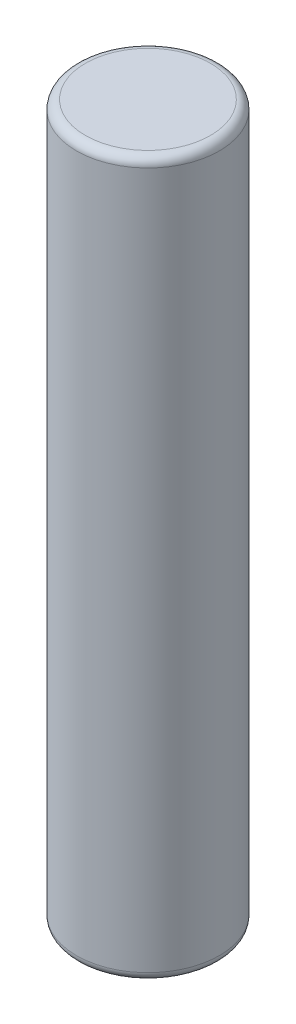
from build123d import *

# Parameters (mm, degrees)
SKETCH1_R           = 4
BOSS_EXTRUDE1_DEPTH = 40
FILLET1_R           = 0.5


with BuildPart() as part:
    # Sketch1 → Boss-Extrude1 (new body)
    with BuildSketch(Plane(origin=(0, 0, 0), x_dir=(1, 0, 0), z_dir=(0, 1, 0))):
        with Locations(Location((0, 0, 0), (0, 0, 270))):
            Circle(SKETCH1_R)
    extrude(amount=BOSS_EXTRUDE1_DEPTH)

    # Fillet1
    fillet1_edges = [part.edges().sort_by_distance(p)[0] for p in [
        (0, 0, -4),
        (0, 40, -4),
    ]]
    fillet(fillet1_edges, radius=FILLET1_R)


solid = part.part
